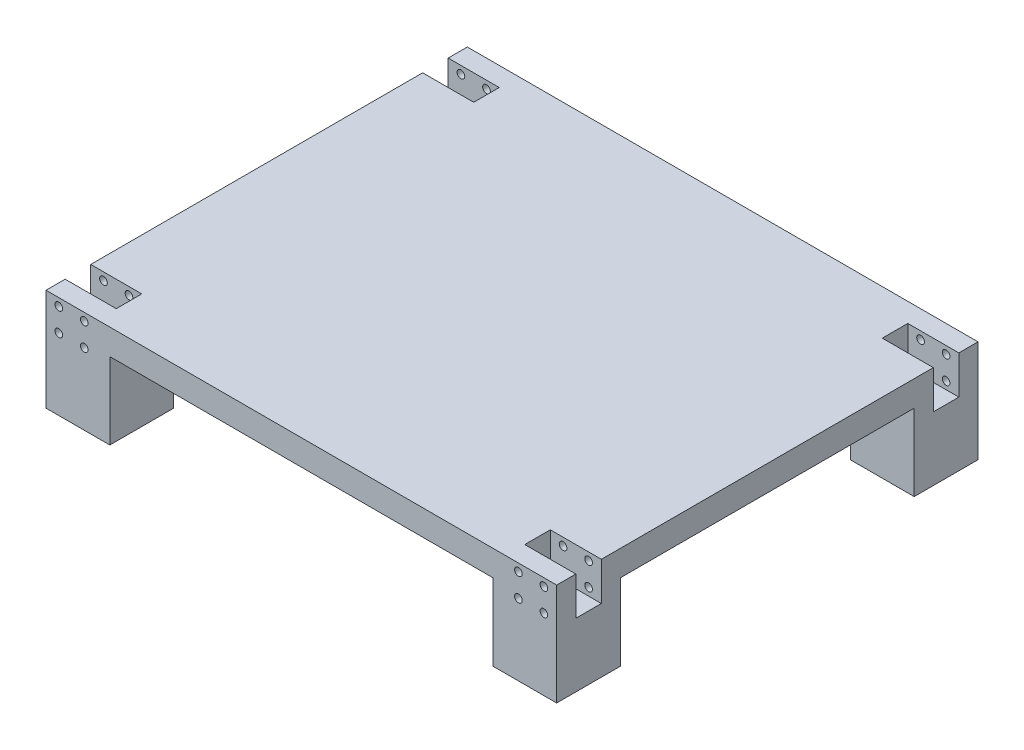
from build123d import *

# Parameters (mm, degrees)
SKETCH_3_W               = 200
SKETCH_3_H               = 165
EXTRUDE_1_DEPTH          = 10
SKETCH_4_W               = 25
SKETCH_4_H               = 25
EXTRUDE_2_DEPTH          = 30
SKETCH_5_W               = 20
SKETCH_5_H               = 10
CUT_EXTRUDE_2_DEPTH      = 15
MIRROR_2_COPY_1_SKETCH_W = 20
MIRROR_2_COPY_1_SKETCH_H = 10
MIRROR_2_COPY_1_DEPTH    = 15
SKETCH_6_R               = 1.5
CUT_EXTRUDE_3_DEPTH      = 20
MIRROR_4_COPY_1_SKETCH_R = 1.5
MIRROR_4_COPY_1_DEPTH    = 20


with BuildPart() as part:
    # 草图3 → 凸台-拉伸1 (new body)
    with BuildSketch(Plane(origin=(0, 0, 0), x_dir=(1, 0, 0), z_dir=(0, 1, 0))):
        Rectangle(SKETCH_3_W, SKETCH_3_H)
    extrude(amount=-EXTRUDE_1_DEPTH)

    # 草图4 → 凸台-拉伸2 (add)
    with BuildSketch(Plane.XZ.offset(10)):
        with Locations((-87.5, 70)):
            Rectangle(SKETCH_4_W, SKETCH_4_H)
        with Locations((87.5, 70)):
            Rectangle(SKETCH_4_W, SKETCH_4_H)
        with Locations((-87.5, -70)):
            Rectangle(SKETCH_4_W, SKETCH_4_H)
        with Locations((87.5, -70)):
            Rectangle(SKETCH_4_W, SKETCH_4_H)
    extrude(amount=EXTRUDE_2_DEPTH)

    # 草图5 → 切除-拉伸2 (cut)
    with BuildSketch(Plane(origin=(0, 0, 0), x_dir=(1, 0, 0), z_dir=(0, 1, 0))):
        with Locations((-90, 70)):
            Rectangle(SKETCH_5_W, SKETCH_5_H)
    cut_extrude_2 = extrude(amount=-CUT_EXTRUDE_2_DEPTH, mode=Mode.SUBTRACT)

    # 镜向1: 切除-拉伸2 across plane
    add(cut_extrude_2.mirror(Plane.XY), mode=Mode.SUBTRACT)

    # 镜向2: 切除-拉伸2 across plane
    add(cut_extrude_2.mirror(Plane(origin=(0, 0, 0), x_dir=(0, 0, 1), z_dir=(1, 0, 0))), mode=Mode.SUBTRACT)

    # 镜向2 copy 1 sketch → 镜向2 copy 1 (cut)
    with BuildSketch(Plane(origin=(0, 0, 0), x_dir=(-1, 0, 0), z_dir=(0, 1, 0))):
        with Locations((-90, 70)):
            Rectangle(MIRROR_2_COPY_1_SKETCH_W, MIRROR_2_COPY_1_SKETCH_H)
    extrude(amount=-MIRROR_2_COPY_1_DEPTH, mode=Mode.SUBTRACT)

    # 草图6 → 切除-拉伸3 (cut)
    with BuildSketch(Plane.XY.offset(82.5)):
        with Locations((-95, -3)):
            Circle(SKETCH_6_R)
        with Locations((-85, -3)):
            Circle(SKETCH_6_R)
        with Locations((-95, -12)):
            Circle(SKETCH_6_R)
        with Locations((-85, -12)):
            Circle(SKETCH_6_R)
    cut_extrude_3 = extrude(amount=-CUT_EXTRUDE_3_DEPTH, mode=Mode.SUBTRACT)

    # 镜向3: 切除-拉伸3 across plane
    add(cut_extrude_3.mirror(Plane.XY), mode=Mode.SUBTRACT)

    # 镜向4: 切除-拉伸3 across plane
    add(cut_extrude_3.mirror(Plane(origin=(0, 0, 0), x_dir=(0, 0, 1), z_dir=(1, 0, 0))), mode=Mode.SUBTRACT)

    # 镜向4 copy 1 sketch → 镜向4 copy 1 (cut)
    with BuildSketch(Plane(origin=(0, 0, -82.5), x_dir=(-1, 0, 0), z_dir=(0, 0, -1))):
        with Locations((-95, -3)):
            Circle(MIRROR_4_COPY_1_SKETCH_R)
        with Locations((-85, -3)):
            Circle(MIRROR_4_COPY_1_SKETCH_R)
        with Locations((-95, -12)):
            Circle(MIRROR_4_COPY_1_SKETCH_R)
        with Locations((-85, -12)):
            Circle(MIRROR_4_COPY_1_SKETCH_R)
    extrude(amount=-MIRROR_4_COPY_1_DEPTH, mode=Mode.SUBTRACT)


solid = part.part
